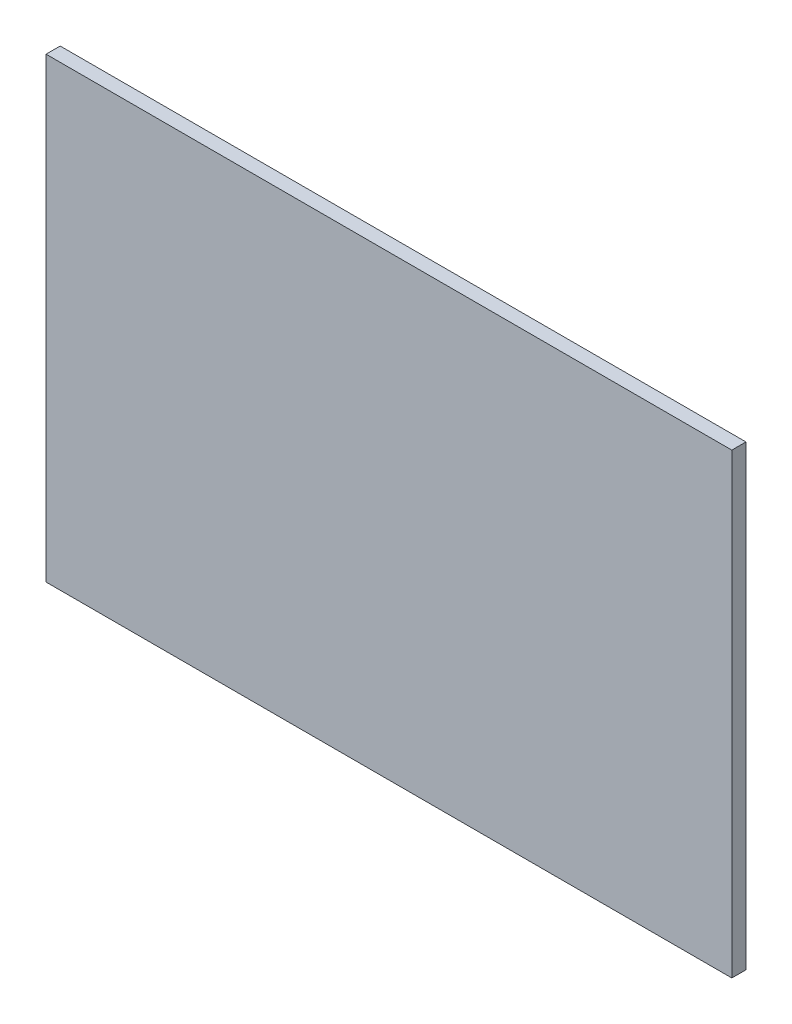
from build123d import *

# Parameters (mm, degrees)
BOSS_EXTRUDE1_DEPTH = 6


with BuildPart() as part:
    # Sketch1 → Boss-Extrude1 (new body)
    with BuildSketch(Plane.XY):
        Polygon((0, 0), (0, -194), (291, -194), (291, -122), (291, -72), (291, 0), align=None)
    extrude(amount=BOSS_EXTRUDE1_DEPTH)


solid = part.part
